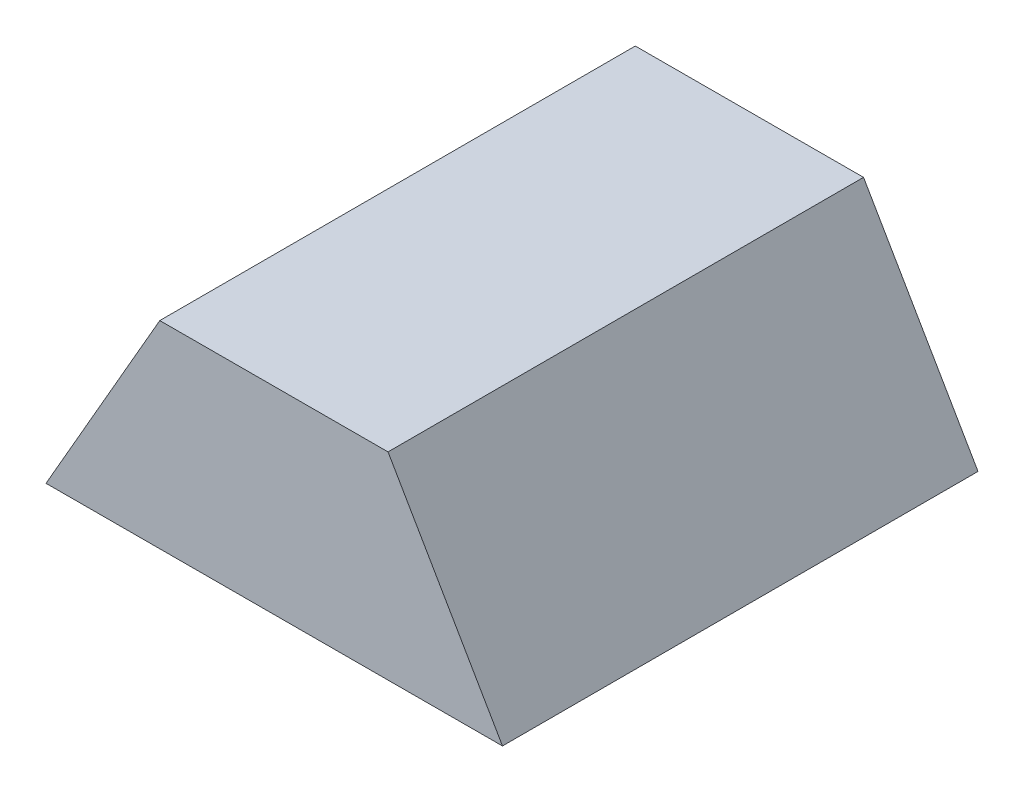
from build123d import *

# Parameters (mm, degrees)
SALIENTE_EXTRUIR1_DEPTH = 50
CROQUIS3_R              = 5
CORTAR_EXTRUIR1_DEPTH   = 10


with BuildPart() as part:
    # Croquis2 → Saliente-Extruir1 (new body)
    with BuildSketch(Plane.XY):
        Polygon((-24, -0.041121621), (24, 0.041121621), (11.964387631, 20.805170501), (-12.035612369, 20.76404888), align=None)
    extrude(amount=SALIENTE_EXTRUIR1_DEPTH)

    # Croquis3 → Cortar-Extruir1 (cut)
    with BuildSketch(Plane(origin=(0, 0, 0), x_dir=(-1, 0, 0), z_dir=(0, 0, -1))):
        with Locations((0, 9.933048714)):
            Circle(CROQUIS3_R)
    extrude(amount=-CORTAR_EXTRUIR1_DEPTH, mode=Mode.SUBTRACT)


solid = part.part
